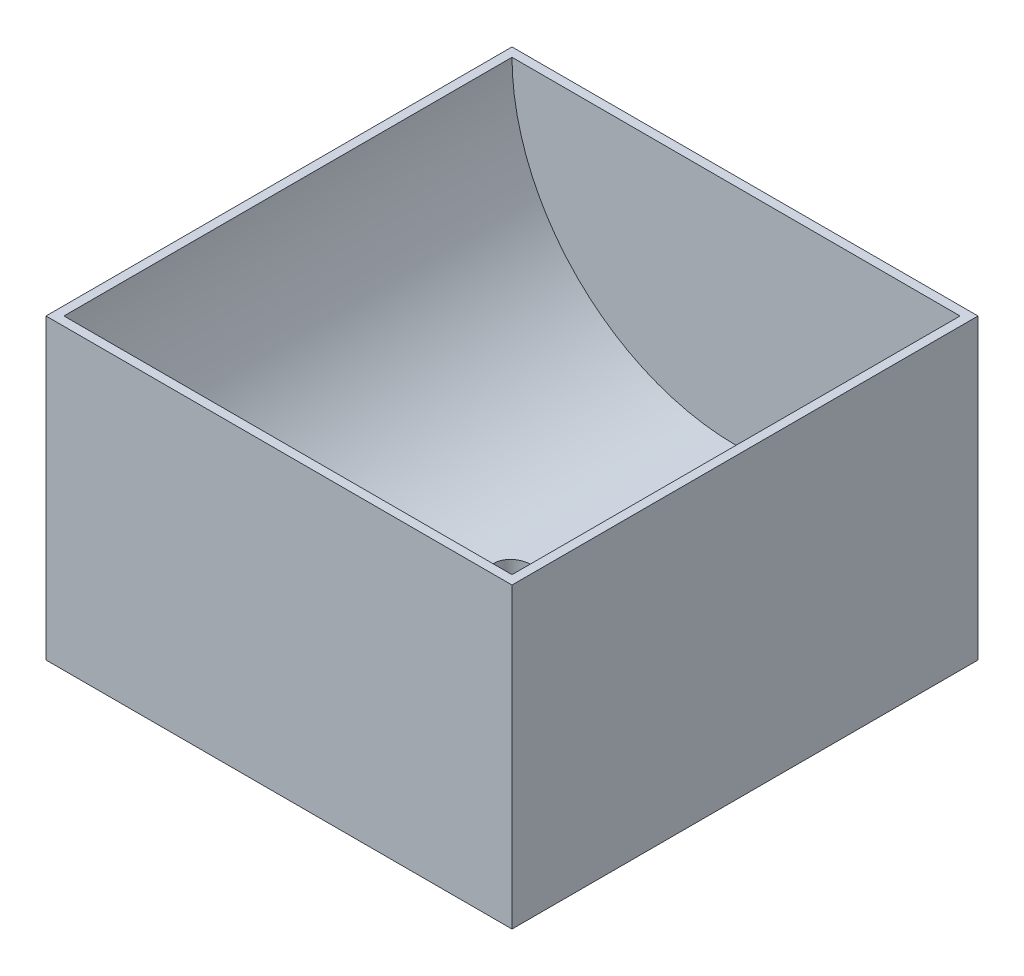
from build123d import *

# Parameters (mm, degrees)
BOSS_EXTRUDE1_DEPTH = 50
SKETCH2_W           = 104
SKETCH2_H           = 53
BOSS_EXTRUDE2_DEPTH = 2
SKETCH3_W           = 104
SKETCH3_H           = 53
BOSS_EXTRUDE3_DEPTH = 2
SKETCH4_R           = 4.05
CUT_EXTRUDE2_DEPTH  = 91.647669578
SKETCH5_W           = 104
SKETCH5_H           = 104
BOSS_EXTRUDE4_DEPTH = 13.5
SKETCH6_R           = 8
CUT_EXTRUDE3_DEPTH  = 7


with BuildPart() as part:
    # Sketch1 → Boss-Extrude1 (new, symmetric)
    with BuildSketch(Plane.XY):
        with BuildLine():
            Line((50, 0), (52, 0))
            Line((52, 0), (52, -53))
            Line((52, -53), (-52, -53))
            Line((-52, -53), (-52, 0))
            Line((-52, 0), (-50, 0))
            ThreePointArc((-50, 0), (0, -50), (50, 0))
        make_face()
    extrude(amount=BOSS_EXTRUDE1_DEPTH, both=True)

    # Sketch2 → Boss-Extrude2 (add)
    with BuildSketch(Plane.XY.offset(50)):
        with Locations((0, -26.5)):
            Rectangle(SKETCH2_W, SKETCH2_H)
    extrude(amount=BOSS_EXTRUDE2_DEPTH)

    # Sketch3 → Boss-Extrude3 (add)
    with BuildSketch(Plane(origin=(0, 0, -50), x_dir=(-1, 0, 0), z_dir=(0, 0, -1))):
        with Locations((0, -26.5)):
            Rectangle(SKETCH3_W, SKETCH3_H)
    extrude(amount=BOSS_EXTRUDE3_DEPTH)

    # Sketch4 → Cut-Extrude2 (cut, through all)
    with BuildSketch(Plane.XZ.offset(53)):
        with Locations(Location((0, 0, 0), (0, 0, 270))):
            Circle(SKETCH4_R)
    extrude(amount=-CUT_EXTRUDE2_DEPTH, mode=Mode.SUBTRACT)

    # Sketch5 → Boss-Extrude4 (add)
    with BuildSketch(Plane.XZ.offset(53)):
        Rectangle(SKETCH5_W, SKETCH5_H)
        Polygon((-7.505553499, 0), (-3.75277675, -6.5), (3.75277675, -6.5), (7.505553499, 0), (3.75277675, 6.5), (-3.75277675, 6.5), align=None, mode=Mode.SUBTRACT)
    extrude(amount=BOSS_EXTRUDE4_DEPTH)

    # Sketch6 → Cut-Extrude3 (cut)
    with BuildSketch(Plane.XZ.offset(66.5)):
        with Locations(Location((0, 0, 0), (0, 0, 270))):
            Circle(SKETCH6_R)
    extrude(amount=-CUT_EXTRUDE3_DEPTH, mode=Mode.SUBTRACT)


solid = part.part
